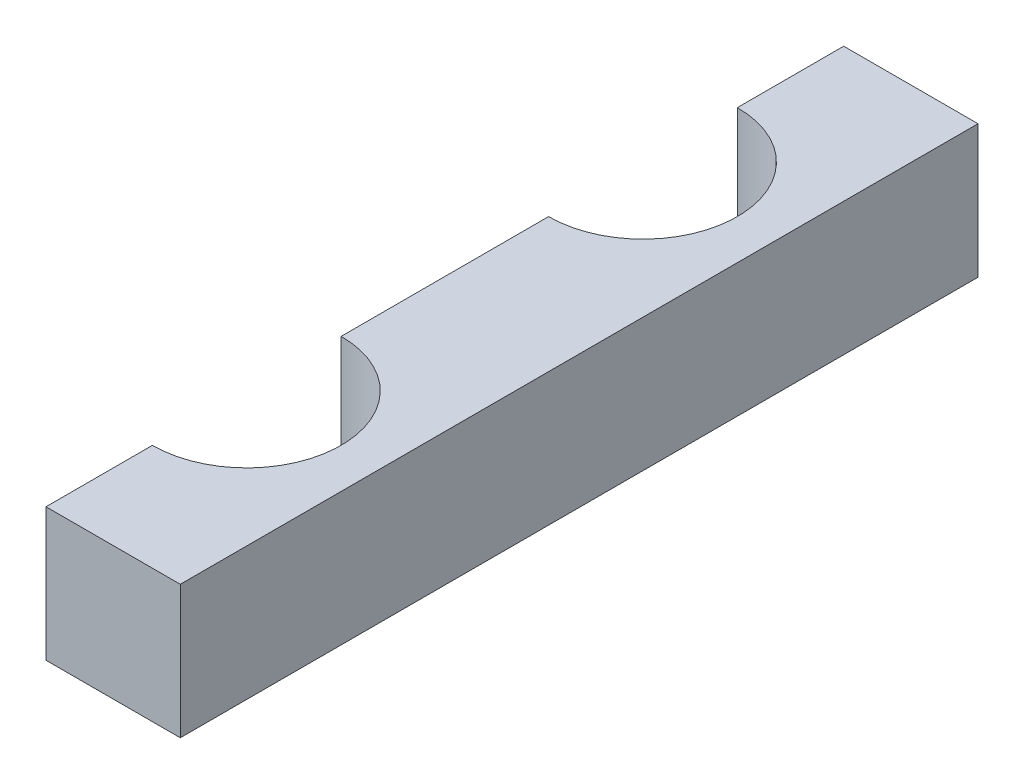
from build123d import *

# Parameters (mm, degrees)
EXTRUDE_1_DEPTH = 10


with BuildPart() as part:
    # Эскиз2 → Бобышка-Вытянуть1 (new body)
    with BuildSketch(Plane(origin=(0, 382.645061039, 0), x_dir=(1, 0, 0), z_dir=(0, 1, 0))):
        with BuildLine():
            Line((3.565848943, 102.773881836), (3.565848943, 110.773881836))
            Line((3.565848943, 110.773881836), (13.665848943, 110.773881836))
            Line((13.665848943, 110.773881836), (13.665848943, 50.773881836))
            Line((13.665848943, 50.773881836), (3.565848943, 50.773881836))
            Line((3.565848943, 50.773881836), (3.565848943, 58.773881836))
            ThreePointArc((3.565848943, 58.773881836), (10.665848943, 65.873881836), (3.565848943, 72.973881836))
            Line((3.565848943, 72.973881836), (3.565848943, 88.573881836))
            ThreePointArc((3.565848943, 88.573881836), (10.665848943, 95.673881836), (3.565848943, 102.773881836))
        make_face()
    extrude(amount=-EXTRUDE_1_DEPTH)


solid = part.part
